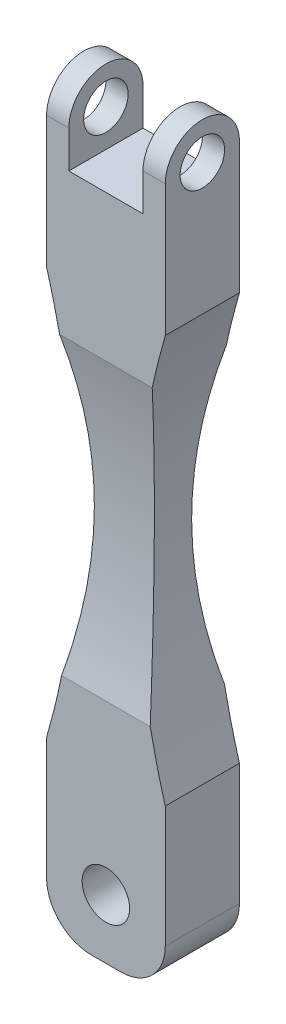
from build123d import *

# Parameters (mm, degrees)
SKETCH1_R           = 1.6
BOSS_EXTRUDE1_DEPTH = 5
SKETCH2_W           = 5
SKETCH2_H           = 5
CUT_EXTRUDE1_DEPTH  = 11
FILLET4_RADIUS      = 2.5
FILLET4_LENGTH      = 1.5
FILLET5_RADIUS      = 2.5
FILLET5_LENGTH      = 1.5
SKETCH3_R           = 1.5
CUT_EXTRUDE2_DEPTH  = 11
CUT_EXTRUDE3_DEPTH  = 11
CUT_EXTRUDE4_DEPTH  = 11


with BuildPart() as part:
    # Sketch1 → Boss-Extrude1 (new body)
    with BuildSketch(Plane.XY):
        with BuildLine():
            Line((-1, -25), (1, -25))
            ThreePointArc((1, -25), (3.121320344, -24.121320344), (4, -22))
            Line((4, -22), (4, 25))
            Line((4, 25), (-4, 25))
            Line((-4, 25), (-4, -22))
            ThreePointArc((-4, -22), (-3.121320344, -24.121320344), (-1, -25))
        make_face()
        with Locations((0, -21)):
            Circle(SKETCH1_R, mode=Mode.SUBTRACT)
    extrude(amount=BOSS_EXTRUDE1_DEPTH)

    # Sketch2 → Cut-Extrude1 (cut)
    with BuildSketch(Plane.XY.offset(5)):
        with Locations((0, 22.5)):
            Rectangle(SKETCH2_W, SKETCH2_H)
    extrude(amount=-CUT_EXTRUDE1_DEPTH, mode=Mode.SUBTRACT)

    # Fillet4: full round fillet: the end face becomes a half cylinder, R = half its width
    fillet4_face = Plane((-3.25, 25, 2.5), x_dir=(-1, 0, 0), z_dir=(0, 1, 0))  # on the end face: x along it, z out of the body
    fillet4_slab = fillet4_face.offset(-FILLET4_RADIUS / 2) * Box(FILLET4_LENGTH, 2 * FILLET4_RADIUS, FILLET4_RADIUS, mode=Mode.PRIVATE)  # the body's end, R deep
    fillet4_round = Plane((-3.25, 22.5, 2.5), x_dir=(0, 1, 0), z_dir=(-1, 0, 0)) * Cylinder(FILLET4_RADIUS, FILLET4_LENGTH, mode=Mode.PRIVATE)  # its axis R under the face
    add(fillet4_slab - fillet4_round, mode=Mode.SUBTRACT)

    # Fillet5: full round fillet: the end face becomes a half cylinder, R = half its width
    fillet5_face = Plane((3.25, 25, 2.5), x_dir=(1, 0, 0), z_dir=(0, 1, 0))  # on the end face: x along it, z out of the body
    fillet5_slab = fillet5_face.offset(-FILLET5_RADIUS / 2) * Box(FILLET5_LENGTH, 2 * FILLET5_RADIUS, FILLET5_RADIUS, mode=Mode.PRIVATE)  # the body's end, R deep
    fillet5_round = Plane((3.25, 22.5, 2.5), x_dir=(0, 1, 0), z_dir=(1, 0, 0)) * Cylinder(FILLET5_RADIUS, FILLET5_LENGTH, mode=Mode.PRIVATE)  # its axis R under the face
    add(fillet5_slab - fillet5_round, mode=Mode.SUBTRACT)

    # Sketch3 → Cut-Extrude2 (cut)
    with BuildSketch(Plane(origin=(4, 0, 0), x_dir=(0, 0, -1), z_dir=(1, 0, 0))):
        with Locations((-2.5, 22.5)):
            Circle(SKETCH3_R)
    extrude(amount=-CUT_EXTRUDE2_DEPTH, mode=Mode.SUBTRACT)

    # Sketch4 → Cut-Extrude3 (cut)
    with BuildSketch(Plane(origin=(4, 0, 0), x_dir=(0, 0, -1), z_dir=(1, 0, 0))):
        with BuildLine():
            Line((-5.938187825, 13.381747244), (-5.854447702, -12.661430853))
            add(Edge.make_bspline(
                [(-5.938187825, 13.381747244), (-1.624651823, 0.354662238), (-5.854447702, -12.661430853)],
                knots=[0, 0, 0, 1, 1, 1], degree=2))
        make_face()
        with BuildLine():
            Line((0.938187825, 13.381747244), (0.854447702, -12.661430853))
            add(Edge.make_bspline(
                [(0.938187825, 13.381747244), (-3.375348177, 0.354662238), (0.854447702, -12.661430853)],
                knots=[0, 0, 0, 1, 1, 1], degree=2))
        make_face()
    extrude(amount=-CUT_EXTRUDE3_DEPTH, mode=Mode.SUBTRACT)

    # Sketch5 → Cut-Extrude4 (cut)
    with BuildSketch(Plane.XY.offset(5)):
        with BuildLine():
            Line((-5.246369121, -17.605604068), (-4.943693979, 16.596686929))
            add(Edge.make_bspline(
                [(-4.943693979, 16.596686929), (1.055826259, -0.52557817), (-5.246369121, -17.605604068)],
                knots=[0, 0, 0, 1, 1, 1], degree=2))
        make_face()
        with BuildLine():
            Line((5.246369121, -17.605604068), (4.943693979, 16.596686929))
            add(Edge.make_bspline(
                [(4.943693979, 16.596686929), (-1.055826259, -0.52557817), (5.246369121, -17.605604068)],
                knots=[0, 0, 0, 1, 1, 1], degree=2))
        make_face()
    extrude(amount=-CUT_EXTRUDE4_DEPTH, mode=Mode.SUBTRACT)


solid = part.part
